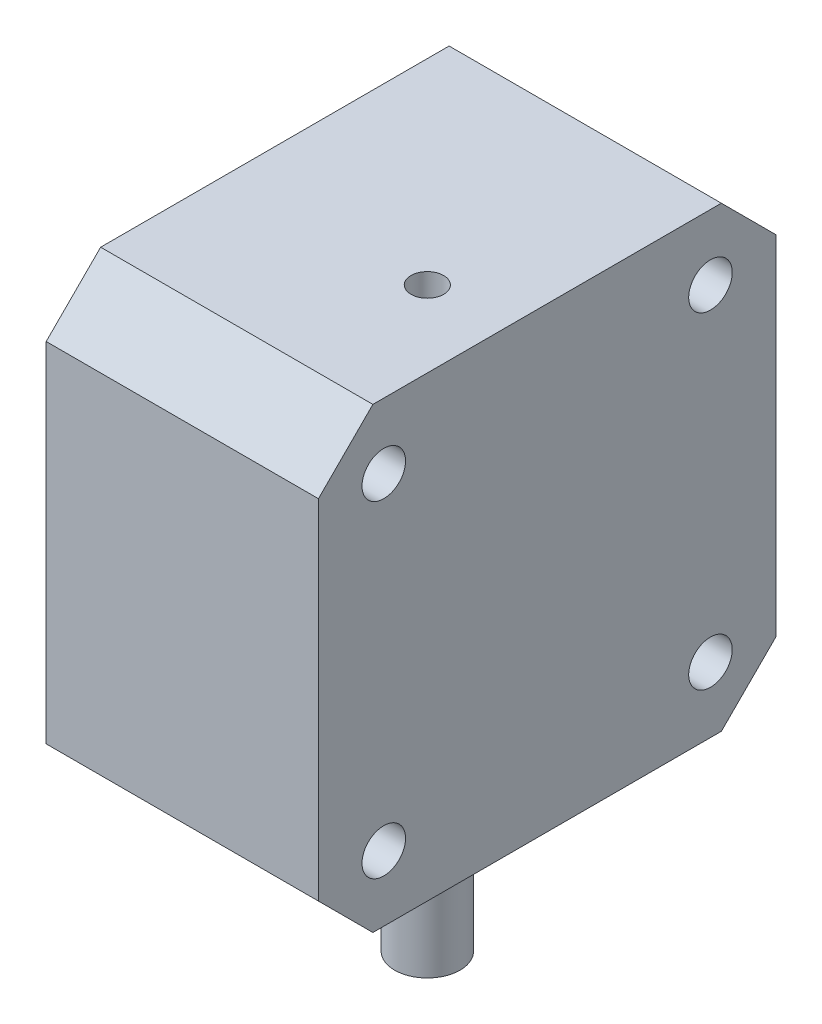
from build123d import *

# Parameters (mm, degrees)
SKETCH1_W           = 42
SKETCH1_H           = 42
BOSS_EXTRUDE1_DEPTH = 25
SKETCH2_R           = 3
BOSS_EXTRUDE2_DEPTH = 11
CUT_EXTRUDE1_DEPTH  = 42
SKETCH4_R           = 1.5
CUT_EXTRUDE2_DEPTH  = 100
CHAMFER2_SIZE       = 5


with BuildPart() as part:
    # Sketch1 → Boss-Extrude1 (new body)
    with BuildSketch(Plane(origin=(0, 0, 0), x_dir=(0, 0, -1), z_dir=(1, 0, 0))):
        with Locations((21, 21)):
            Rectangle(SKETCH1_W, SKETCH1_H)
    extrude(amount=BOSS_EXTRUDE1_DEPTH)

    # Sketch2 → Boss-Extrude2 (add)
    with BuildSketch(Plane.XZ):
        with Locations(Location((18, -17, 0), (0, 0, 90))):
            Circle(SKETCH2_R)
    extrude(amount=BOSS_EXTRUDE2_DEPTH)

    # Sketch3 → Cut-Extrude1 (cut)
    with BuildSketch(Plane(origin=(25, 0, 0), x_dir=(0, 0, -1), z_dir=(1, 0, 0))):
        with BuildLine():
            ThreePointArc((8, 36), (4.585786438, 37.414213562), (6, 34))
            Line((6, 34), (6, 36))
            Line((6, 36), (8, 36))
        make_face()
        with BuildLine():
            Line((6, 36), (6, 34))
            ThreePointArc((6, 34), (7.414213562, 34.585786438), (8, 36))
            Line((8, 36), (6, 36))
        make_face()
        with BuildLine():
            ThreePointArc((34, 36), (34.585786438, 34.585786438), (36, 34))
            Line((36, 34), (36, 36))
            Line((36, 36), (34, 36))
        make_face()
        with BuildLine():
            Line((36, 36), (36, 34))
            ThreePointArc((36, 34), (37.414213562, 34.585786438), (38, 36))
            ThreePointArc((38, 36), (36, 38), (34, 36))
            Line((34, 36), (36, 36))
        make_face()
        with BuildLine():
            Line((6, 8), (6, 6))
            Line((6, 6), (8, 6))
            ThreePointArc((8, 6), (7.414213562, 7.414213562), (6, 8))
        make_face()
        with BuildLine():
            Line((8, 6), (6, 6))
            Line((6, 6), (6, 8))
            ThreePointArc((6, 8), (4.585786438, 4.585786438), (8, 6))
        make_face()
        with BuildLine():
            ThreePointArc((36, 8), (34.585786438, 7.414213562), (34, 6))
            Line((34, 6), (36, 6))
            Line((36, 6), (36, 8))
        make_face()
        with BuildLine():
            Line((36, 6), (34, 6))
            ThreePointArc((34, 6), (36, 4), (38, 6))
            ThreePointArc((38, 6), (37.414213562, 7.414213562), (36, 8))
            Line((36, 8), (36, 6))
        make_face()
    extrude(amount=-CUT_EXTRUDE1_DEPTH, mode=Mode.SUBTRACT)

    # Sketch4 → Cut-Extrude2 (cut)
    with BuildSketch(Plane.XZ.offset(11)):
        with Locations(Location((18, -17, 0), (0, 0, 270))):
            Circle(SKETCH4_R)
    extrude(amount=-CUT_EXTRUDE2_DEPTH, mode=Mode.SUBTRACT)

    # Chamfer2
    chamfer2_edges = [part.edges().sort_by_distance(p)[0] for p in [
        (12.5, 42, 0),
        (12.5, 42, -42),
        (12.5, 0, -42),
        (12.5, 0, 0),
    ]]
    chamfer(chamfer2_edges, length=CHAMFER2_SIZE)


solid = part.part
